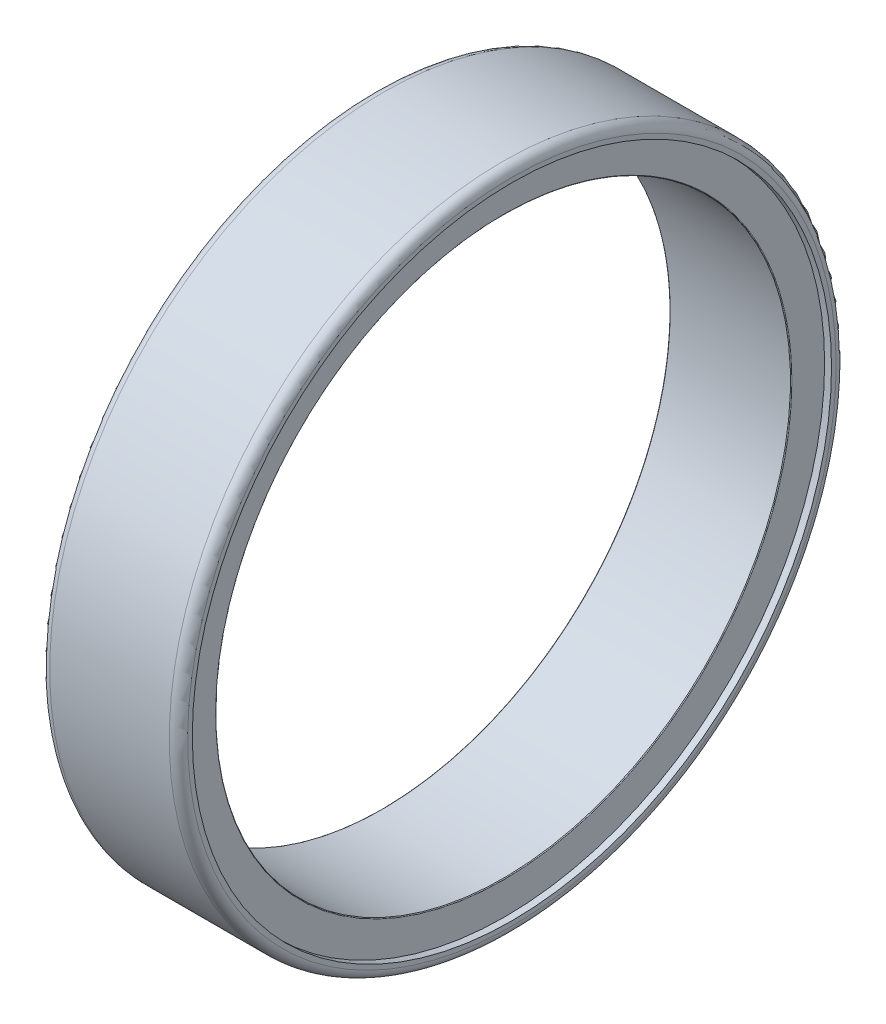
from build123d import *


with BuildPart() as part:
    # InnRacSke → Race (revolve)
    with BuildSketch(Plane.XY):
        with BuildLine():
            Line((-5.4, 27.8), (-6, 27.8))
            Line((-6, 27.8), (-6, 28.2))
            ThreePointArc((-6, 28.2), (-5.765685425, 28.765685425), (-5.2, 29))
            Line((-5.2, 29), (5.2, 29))
            ThreePointArc((5.2, 29), (5.765685425, 28.765685425), (6, 28.2))
            Line((6, 28.2), (6, 27.8))
            Line((6, 27.8), (5.4, 27.8))
            Line((5.4, 27.8), (5.4, 28.2))
            Line((5.4, 28.2), (-5.4, 28.2))
            Line((-5.4, 28.2), (-5.4, 27.8))
        make_face()
    revolve(axis=Axis((-31.75, 0, 0), (1, 0, 0)))

    # RolSimSke → RollersSimplified (revolve)
    with BuildSketch(Plane.XY):
        with BuildLine():
            Line((-5.22798, 28.201), (5.22798, 28.201))
            ThreePointArc((5.22798, 28.201), (5.273248976, 28.182248976), (5.292, 28.13698))
            Line((5.292, 28.13698), (5.292, 25.06402))
            ThreePointArc((5.292, 25.06402), (5.273248976, 25.018751024), (5.22798, 25))
            Line((5.22798, 25), (-5.22798, 25))
            ThreePointArc((-5.22798, 25), (-5.273248976, 25.018751024), (-5.292, 25.06402))
            Line((-5.292, 25.06402), (-5.292, 28.13698))
            ThreePointArc((-5.292, 28.13698), (-5.273248976, 28.182248976), (-5.22798, 28.201))
        make_face()
    revolve(axis=Axis((-25.4, 0, 0), (1, 0, 0)))


solid = part.part
